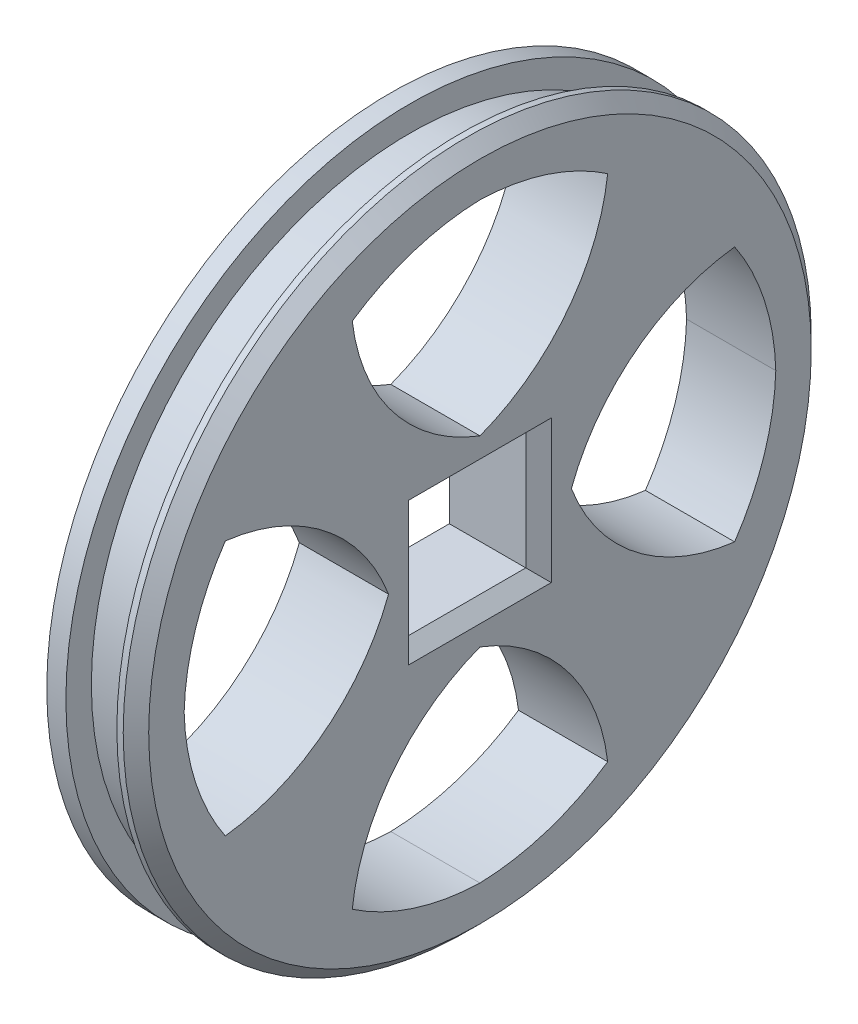
from build123d import *

# Parameters (mm, degrees)
SKETCH1_R               = 13.5
BOSS_EXTRUDE1_DEPTH     = 1.75
CUT_EXTRUDE1_DEPTH      = 20.17191957
CIRPATTERN1_COUNT       = 4
CUT_EXTRUDE2_DEPTH      = 20.17191957
CUT_EXTRUDE2_DEPTH_BACK = 20.17191957
SKETCH3_W               = 4.596194078
SKETCH3_H               = 4.596194078
CHAMFER1_SIZE           = 0.5
SKETCH4_R               = 13.5
SKETCH4_R_2             = 12.5
CUT_EXTRUDE3_DEPTH      = 1


with BuildPart() as part:
    # Sketch1 → Boss-Extrude1 (new, symmetric)
    with BuildSketch(Plane(origin=(0, 0, 0), x_dir=(0, 0, -1), z_dir=(1, 0, 0))):
        Circle(SKETCH1_R)
    extrude(amount=BOSS_EXTRUDE1_DEPTH, both=True)

    # Sketch2 → Cut-Extrude1 (cut, symmetric)
    with BuildSketch(Plane(origin=(0, 0, 0), x_dir=(0, 0, -1), z_dir=(1, 0, 0))):
        with BuildLine():
            ThreePointArc((0, 3.587478321), (-3.402339743, 6.089548883), (-5.012219469, 9.99397715))
            ThreePointArc((-5.012219469, 9.99397715), (-2.621563936, 11.159720287), (0, 11.6087119))
            ThreePointArc((0, 11.6087119), (2.621563936, 11.159720287), (5.012219469, 9.99397715))
            ThreePointArc((5.012219469, 9.99397715), (3.402339743, 6.089548883), (0, 3.587478321))
        make_face()
    cut_extrude1 = extrude(amount=CUT_EXTRUDE1_DEPTH, both=True, mode=Mode.SUBTRACT)

    # CirPattern1: Cut-Extrude1 ×4 about axis
    cirpattern1_axis = Axis((0, 0, 0), (1, 0, 0))
    for i in range(1, CIRPATTERN1_COUNT):
        add(cut_extrude1.rotate(cirpattern1_axis, i * 360 / CIRPATTERN1_COUNT), mode=Mode.SUBTRACT)

    # Sketch3 → Cut-Extrude2 (cut, two sides: drawn at the far end of the back side and taken through both)
    with BuildSketch(Plane(origin=(0, 0, 0), x_dir=(0, 0, -1), z_dir=(1, 0, 0)).offset(-CUT_EXTRUDE2_DEPTH_BACK)):
        Rectangle(SKETCH3_W, SKETCH3_H)
    extrude(amount=CUT_EXTRUDE2_DEPTH + CUT_EXTRUDE2_DEPTH_BACK, mode=Mode.SUBTRACT)

    # Chamfer1
    chamfer1_edges = [part.edges().sort_by_distance(p)[0] for p in [
        (1.75, 0, 13.5),
        (1.75, 0, 2.298097039),
        (1.75, -2.298097039, 0),
        (1.75, 0, -2.298097039),
        (1.75, 2.298097039, 0),
    ]]
    chamfer(chamfer1_edges, length=CHAMFER1_SIZE)

    # Sketch4 → Cut-Extrude3 (cut, symmetric)
    with BuildSketch(Plane(origin=(0, 0, 0), x_dir=(0, 0, -1), z_dir=(1, 0, 0))):
        Circle(SKETCH4_R)
        Circle(SKETCH4_R_2, mode=Mode.SUBTRACT)
    extrude(amount=CUT_EXTRUDE3_DEPTH, both=True, mode=Mode.SUBTRACT)


solid = part.part
